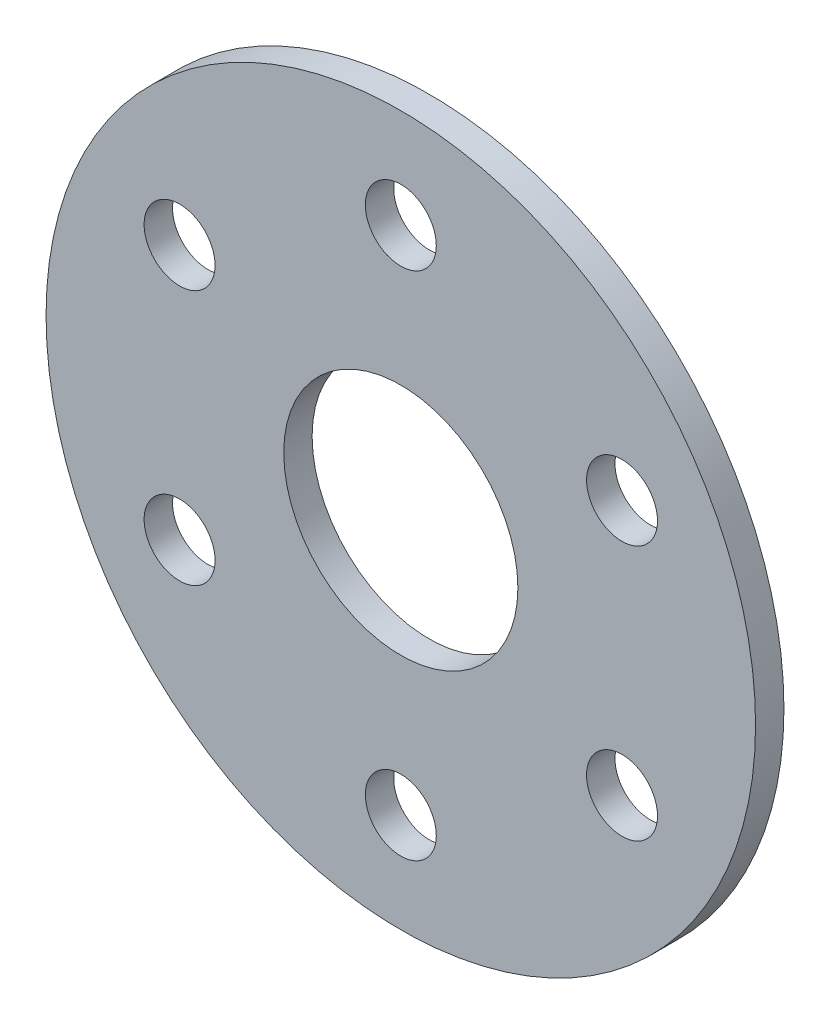
from build123d import *

# Parameters (mm, degrees)
SKETCH1_R           = 25
SKETCH1_R_2         = 8.25
SKETCH1_R_3         = 2.5
BOSS_EXTRUDE1_DEPTH = 1


with BuildPart() as part:
    # Sketch1 → Boss-Extrude1 (new, symmetric)
    with BuildSketch(Plane.XY):
        Circle(SKETCH1_R)
        Circle(SKETCH1_R_2, mode=Mode.SUBTRACT)
        with Locations((0, 18)):
            Circle(SKETCH1_R_3, mode=Mode.SUBTRACT)
        with Locations((15.588457268, 9)):
            Circle(SKETCH1_R_3, mode=Mode.SUBTRACT)
        with Locations((15.588457268, -9)):
            Circle(SKETCH1_R_3, mode=Mode.SUBTRACT)
        with Locations((0, -18)):
            Circle(SKETCH1_R_3, mode=Mode.SUBTRACT)
        with Locations((-15.588457268, -9)):
            Circle(SKETCH1_R_3, mode=Mode.SUBTRACT)
        with Locations((-15.588457268, 9)):
            Circle(SKETCH1_R_3, mode=Mode.SUBTRACT)
    extrude(amount=BOSS_EXTRUDE1_DEPTH, both=True)


solid = part.part
